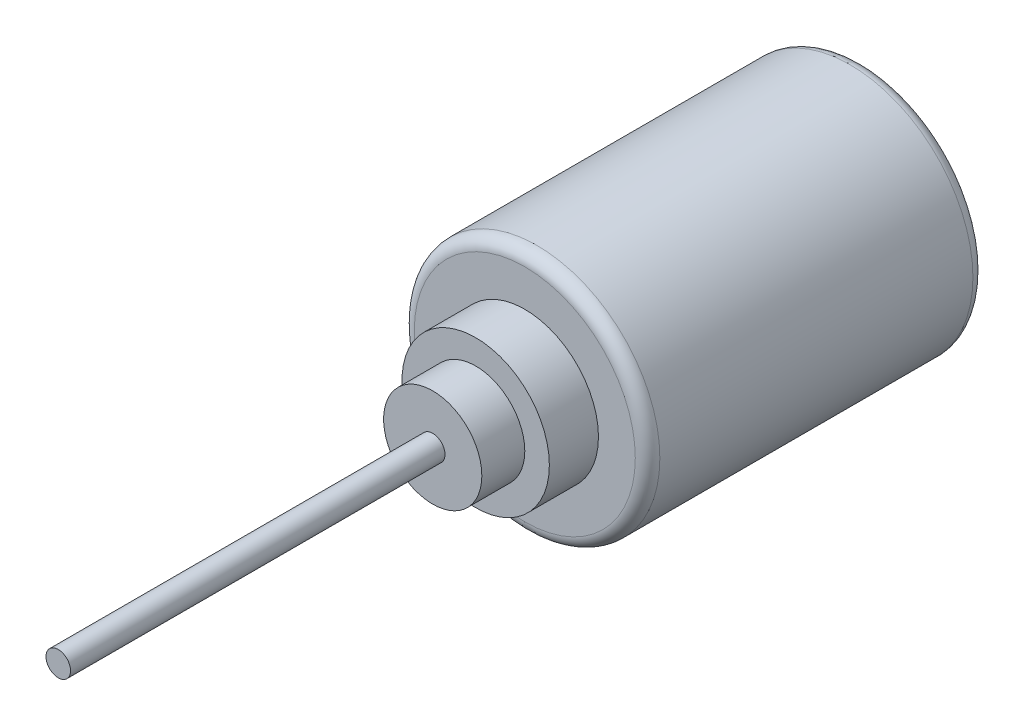
from build123d import *

# Parameters (mm, degrees)
SKETCH1_R           = 20
SKETCH1_R_2         = 2
BOSS_EXTRUDE1_DEPTH = 55
SKETCH1_3_R         = 2
BOSS_EXTRUDE2_DEPTH = 131
SKETCH2_R           = 8
BOSS_EXTRUDE3_DEPTH = 15
SKETCH3_R           = 12
BOSS_EXTRUDE4_DEPTH = 8
FILLET1_R           = 2
SCALE1_SCALE        = 0.5
SCALE2_SCALE        = 0.5
SCALE3_SCALE        = 1.25


with BuildPart() as part:
    # Sketch1 → Boss-Extrude1 (new body)
    with BuildSketch(Plane.XY):
        Circle(SKETCH1_R)
        Circle(SKETCH1_R_2, mode=Mode.SUBTRACT)
    extrude(amount=BOSS_EXTRUDE1_DEPTH)

    # Sketch1<3> → Boss-Extrude2 (add)
    with BuildSketch(Plane.XY):
        Circle(SKETCH1_3_R)
    extrude(amount=BOSS_EXTRUDE2_DEPTH)

    # Sketch2 → Boss-Extrude3 (add)
    with BuildSketch(Plane.XY.offset(55)):
        Circle(SKETCH2_R)
    extrude(amount=BOSS_EXTRUDE3_DEPTH)

    # Sketch3 → Boss-Extrude4 (add)
    with BuildSketch(Plane.XY.offset(55)):
        Circle(SKETCH3_R)
    extrude(amount=BOSS_EXTRUDE4_DEPTH)

    # Fillet1
    fillet1_edges = [part.edges().sort_by_distance(p)[0] for p in [
        (-20, 0, 0),
        (-20, 0, 55),
    ]]
    fillet(fillet1_edges, radius=FILLET1_R)


with BuildPart() as part_1:
    # Scale1: scaled about (0, 0, 30.5101534)
    add(part.part.scale(SCALE1_SCALE).moved(Location((0, 0, 15.2550767))))


with BuildPart() as part_2:
    # Scale2: scaled about (0, 0, 30.5101534)
    add(part_1.part.scale(SCALE2_SCALE).moved(Location((0, 0, 15.2550767))))


with BuildPart() as part_3:
    # Scale3: scaled about (0, 0, 30.5101534)
    add(part_2.part.scale(SCALE3_SCALE).moved(Location((0, 0, -7.62753835))))


solid = part_3.part
